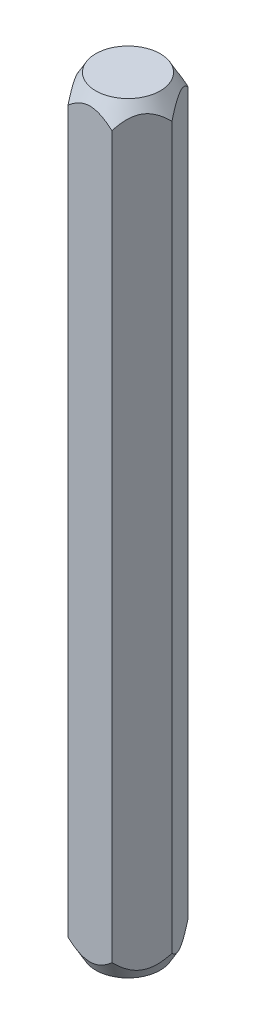
from build123d import *

# Parameters (mm, degrees)
BOSS_EXTRUDE1_DEPTH = 13


with BuildPart() as part:
    # Sketch1 → Boss-Extrude1 (new, symmetric)
    with BuildSketch(Plane(origin=(0, 0, 0), x_dir=(1, 0, 0), z_dir=(0, 1, 0))):
        Polygon((1.5, 0), (0.75, 1.299038106), (-0.75, 1.299038106), (-1.5, 0), (-0.75, -1.299038106), (0.75, -1.299038106), align=None)
    extrude(amount=BOSS_EXTRUDE1_DEPTH, both=True)

    # Sketch2 → Cut-Revolve1 (revolve, cut)
    with BuildSketch(Plane.XY, mode=Mode.PRIVATE) as cut_revolve1_sk:
        Polygon((1.5, 13), (1.5, 12.3), (1.1, 13), align=None)
        Polygon((1.5, -13), (1.5, -12.3), (1.1, -13), align=None)
    revolve(cut_revolve1_sk.sketch.rotate(Axis((0, -13, 0), (0, 1, 0)), 300.000003979), axis=Axis((0, -13, 0), (0, 1, 0)), mode=Mode.SUBTRACT)


solid = part.part
